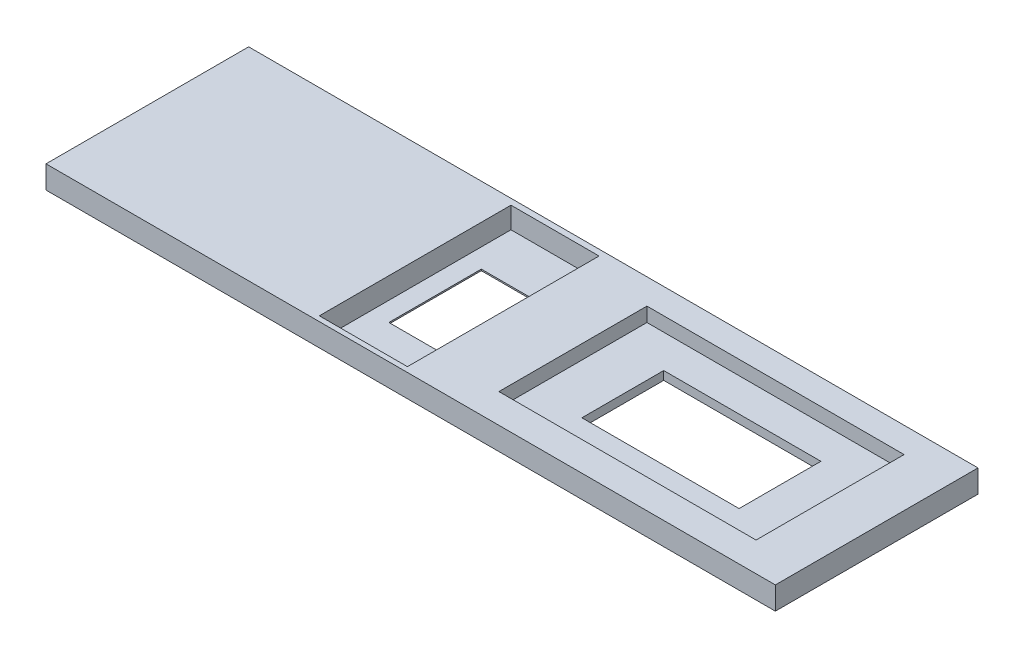
from build123d import *

# Parameters (mm, degrees)
SKETCH1_W           = 512.8
SKETCH1_H           = 142.48
BOSS_EXTRUDE1_DEPTH = 16
SKETCH5_W           = 180.81
SKETCH5_H           = 104.08
CUT_EXTRUDE2_DEPTH  = 10
SKETCH6_W           = 110.54
SKETCH6_H           = 57.54
CUT_EXTRUDE3_DEPTH  = 267.636306605
SKETCH7_W           = 61.93
SKETCH7_H           = 134.73
CUT_EXTRUDE4_DEPTH  = 15
SKETCH8_W           = 35
SKETCH8_H           = 65
CUT_EXTRUDE5_DEPTH  = 5


with BuildPart() as part:
    # Sketch1 → Boss-Extrude1 (new body)
    with BuildSketch(Plane(origin=(0, 0, 0), x_dir=(1, 0, 0), z_dir=(0, 1, 0))):
        with Locations((0, 0.16)):
            Rectangle(SKETCH1_W, SKETCH1_H)
    extrude(amount=BOSS_EXTRUDE1_DEPTH)

    # Sketch5 → Cut-Extrude2 (cut)
    with BuildSketch(Plane(origin=(0, 16, 0), x_dir=(1, 0, 0), z_dir=(0, 1, 0))):
        with Locations((131.895, 1.499952895)):
            Rectangle(SKETCH5_W, SKETCH5_H)
    extrude(amount=-CUT_EXTRUDE2_DEPTH, mode=Mode.SUBTRACT)

    # Sketch6 → Cut-Extrude3 (cut, through all)
    with BuildSketch(Plane(origin=(0, 16, 0), x_dir=(1, 0, 0), z_dir=(0, 1, 0))):
        with Locations((131.895, 1.429952895)):
            Rectangle(SKETCH6_W, SKETCH6_H)
    extrude(amount=-CUT_EXTRUDE3_DEPTH, mode=Mode.SUBTRACT)

    # Sketch7 → Cut-Extrude4 (cut)
    with BuildSketch(Plane(origin=(0, 16, 0), x_dir=(1, 0, 0), z_dir=(0, 1, 0))):
        with Locations((-36.795, -0.164973308)):
            Rectangle(SKETCH7_W, SKETCH7_H)
    extrude(amount=-CUT_EXTRUDE4_DEPTH, mode=Mode.SUBTRACT)

    # Sketch8 → Cut-Extrude5 (cut)
    with BuildSketch(Plane(origin=(0, 1, 0), x_dir=(1, 0, 0), z_dir=(0, 1, 0))):
        with Locations((-36.76, 0.349234115)):
            Rectangle(SKETCH8_W, SKETCH8_H)
    extrude(amount=-CUT_EXTRUDE5_DEPTH, mode=Mode.SUBTRACT)


solid = part.part
